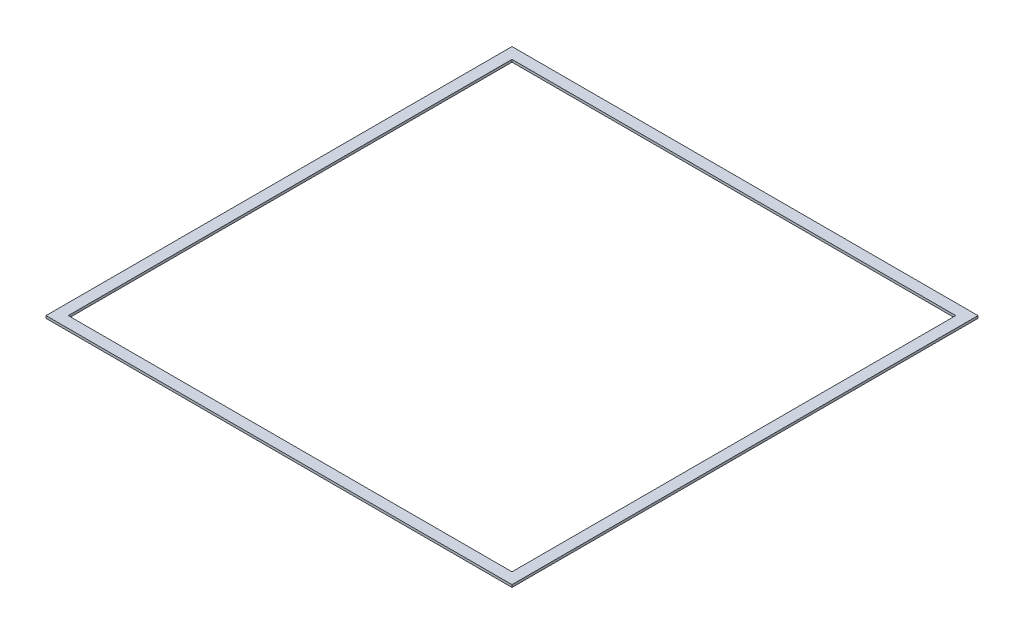
from build123d import *

# Parameters (mm, degrees)
SKETCH1_W           = 419
SKETCH1_H           = 419
SKETCH1_W_2         = 399
SKETCH1_H_2         = 399
BOSS_EXTRUDE1_DEPTH = 1.1


with BuildPart() as part:
    # Sketch1 → Boss-Extrude1 (new, symmetric)
    with BuildSketch(Plane(origin=(0, 0, 0), x_dir=(1, 0, 0), z_dir=(0, 1, 0))):
        Rectangle(SKETCH1_W, SKETCH1_H)
        Rectangle(SKETCH1_W_2, SKETCH1_H_2, mode=Mode.SUBTRACT)
    extrude(amount=BOSS_EXTRUDE1_DEPTH, both=True)


solid = part.part
